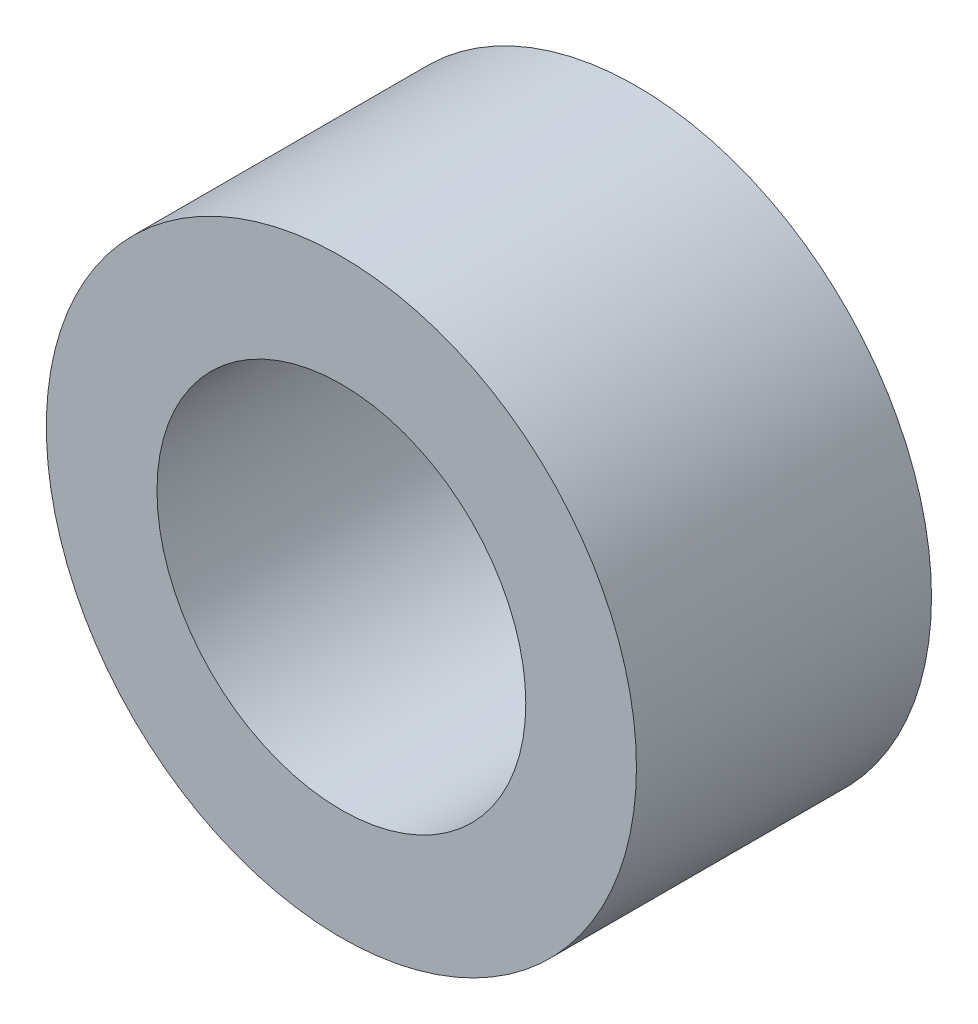
from build123d import *

# Parameters (mm, degrees)
IZIM1_R                     = 5
IZIM1_R_2                   = 3.125
Y_KSEKLIK_EKSTR_ZYON1_DEPTH = 5


with BuildPart() as part:
    # Çizim1 → Yükseklik-Ekstrüzyon1 (new body)
    with BuildSketch(Plane.XY):
        Circle(IZIM1_R)
        Circle(IZIM1_R_2, mode=Mode.SUBTRACT)
    extrude(amount=Y_KSEKLIK_EKSTR_ZYON1_DEPTH)


solid = part.part
